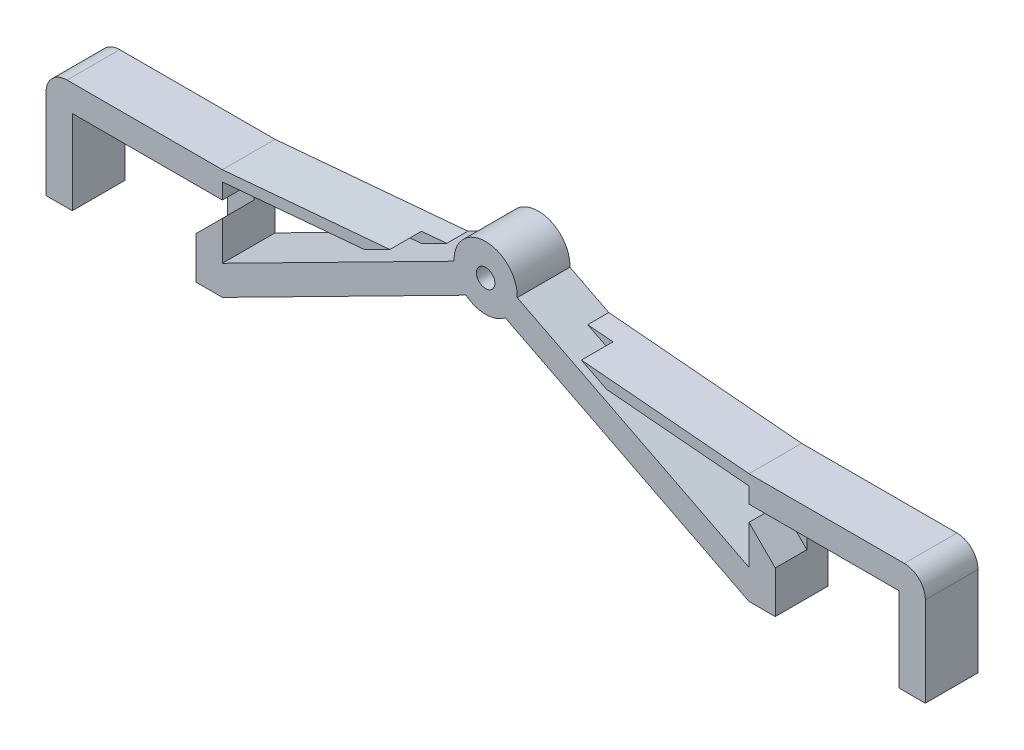
from build123d import *

# Parameters (mm, degrees)
SKICA1_R                 = 1.75
P_IDAT_VYSUNUT_M1_DEPTH  = 5
ZAOBLIT1_R               = 4
P_IDAT_VYSUNUT_M2_DEPTH  = 5
SKICA3_R                 = 1.05
ODEBRAT_VYSUNUT_M1_DEPTH = 6
ODEBRAT_VYSUNUT_M2_DEPTH = 6
ODEBRAT_VYSUNUT_M3_DEPTH = 6
SCALE1_SCALE             = 8


with BuildPart() as part:
    # Skica1 → Přidat vysunutím1 (new, symmetric)
    with BuildSketch(Plane.XY):
        with BuildLine():
            Line((0, 0), (0, 16))
            Line((0, 16), (23.5, 16))
            Line((23.5, 16), (23.5, 0))
            Line((23.5, 0), (28.5, 0))
            Line((28.5, 0), (74.768828107, 23.497329584))
            ThreePointArc((74.768828107, 23.497329584), (78.5, 22.196090729), (82.231171893, 23.497329584))
            Line((82.231171893, 23.497329584), (128.5, 0))
            Line((128.5, 0), (133.5, 0))
            Line((133.5, 0), (133.5, 16))
            Line((133.5, 16), (157, 16))
            Line((157, 16), (157, 0))
            Line((157, 0), (162, 0))
            Line((162, 0), (162, 21))
            Line((162, 21), (128.5, 21))
            Line((128.5, 21), (128.5, 5.607818541))
            Line((128.5, 5.607818541), (84.49517003, 27.955391095))
            ThreePointArc((84.49517003, 27.955391095), (78.5, 34.196090729), (72.50482997, 27.955391095))
            Line((72.50482997, 27.955391095), (28.5, 5.607818541))
            Line((28.5, 5.607818541), (28.5, 21))
            Line((28.5, 21), (-5, 21))
            Line((-5, 21), (-5, 0))
            Line((-5, 0), (0, 0))
        make_face()
        with Locations((78.5, 28.196090729)):
            Circle(SKICA1_R, mode=Mode.SUBTRACT)
    extrude(amount=P_IDAT_VYSUNUT_M1_DEPTH, both=True)

    # Zaoblit1
    zaoblit1_edges = [part.edges().sort_by_distance(p)[0] for p in [
        (-5, 21, 0),
        (162, 21, 0),
    ]]
    fillet(zaoblit1_edges, radius=ZAOBLIT1_R)

    # Skica2 → Přidat vysunutím2 (add, symmetric)
    with BuildSketch(Plane.XY):
        Polygon((28.5, 21), (65.117103916, 24.203581484), (60.341045967, 21.778090882), (28.5, 18.992360325), align=None)
    p_idat_vysunut_m2 = extrude(amount=P_IDAT_VYSUNUT_M2_DEPTH, both=True)

    # Zrcadlit1: Přidat vysunutím2 across plane
    add(p_idat_vysunut_m2.mirror(Plane.ZY.offset(-78.5)))

    # Skica3 → Odebrat vysunutím1 (cut)
    with BuildSketch(Plane.XZ):
        with Locations(Location((-1.75, 0, 0), (0, 0, 270))):
            Circle(SKICA3_R)
        with Locations(Location((25.25, 0, 0), (0, 0, 270))):
            Circle(SKICA3_R)
    odebrat_vysunut_m1 = extrude(amount=-ODEBRAT_VYSUNUT_M1_DEPTH, mode=Mode.SUBTRACT)

    # Zrcadlit2: Odebrat vysunutím1 across plane
    add(odebrat_vysunut_m1.mirror(Plane.ZY.offset(-78.5)), mode=Mode.SUBTRACT)

    # Skica4 → Odebrat vysunutím2 (cut)
    with BuildSketch(Plane.XY.offset(5)):
        Polygon((23.5, 16), (28.5, 16), (28.5, 13), (23.5, 8), align=None)
    odebrat_vysunut_m2 = extrude(amount=-ODEBRAT_VYSUNUT_M2_DEPTH, mode=Mode.SUBTRACT)

    # Zrcadlit3: Odebrat vysunutím2 across plane
    add(odebrat_vysunut_m2.mirror(Plane.ZY.offset(-78.5)), mode=Mode.SUBTRACT)

    # Skica5 → Odebrat vysunutím3 (cut)
    with BuildSketch(Plane.XY.offset(5)):
        Polygon((60.341045967, 21.778090882), (65.117103916, 24.203581484), (60.314461293, 23.783404699), (55.538403344, 21.357914097), align=None)
        Polygon((91.882896084, 24.203581484), (96.685538707, 23.783404699), (101.461596656, 21.357914097), (96.658954033, 21.778090882), align=None)
    extrude(amount=-ODEBRAT_VYSUNUT_M3_DEPTH, mode=Mode.SUBTRACT)


with BuildPart() as part_1:
    # Scale1: scaled about (78.5, 15.605763545, -0.066585977)
    add(part.part.scale(SCALE1_SCALE).moved(Location((-549.5, -109.240344815, 0.466101839))))


solid = part_1.part
